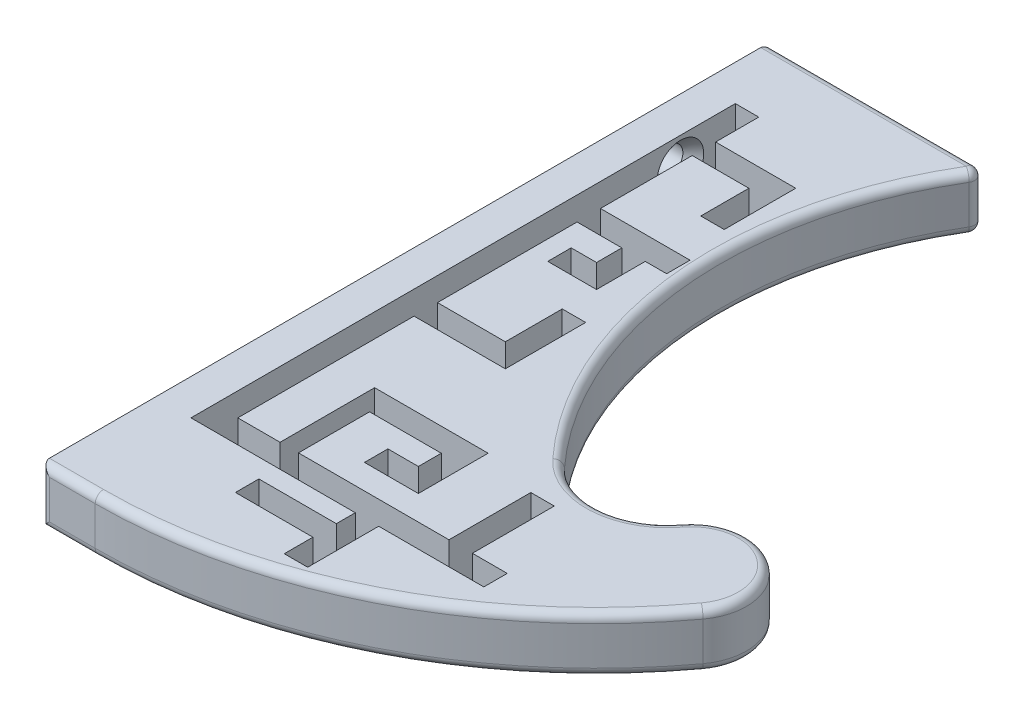
from build123d import *

# Parameters (mm, degrees)
BOSS_EXTRUDE1_DEPTH = 10
FILLET1_R           = 1.5


with BuildPart() as part:
    # Sketch1 → Boss-Extrude1 (new body)
    with BuildSketch(Plane(origin=(0, 0, 0), x_dir=(1, 0, 0), z_dir=(0, 1, 0))):
        with BuildLine():
            Line((0, 132), (0, 0))
            Line((0, 0), (9.806899205, 0))
            ThreePointArc((9.806899205, 0), (50.833969992, 9.773283566), (83.048530962, 36.993857965))
            ThreePointArc((83.048530962, 36.993857965), (81.000199646, 50.92844911), (67.049362803, 48.993857965))
            ThreePointArc((67.049362803, 48.993857965), (57.146860922, 43.813297067), (46.819761712, 48.085155754))
            ThreePointArc((46.819761712, 48.085155754), (29.029737588, 88.873903236), (40, 132))
            Line((40, 132), (0, 132))
        make_face()
        Polygon((6.5, 20.67103065), (6.5, 119.400046722), (10.75, 119.400046722), (10.75, 111.574341839), (25.276432371, 111.574341839), (25.276432371, 107.324341839), (25.276432371, 98.607245151), (21.026432371, 98.607245151), (21.026432371, 107.324341839), (10.75, 107.324341839), (10.75, 90.692748994), (26.995661983, 90.692748994), (26.995661983, 86.442748994), (23.122830992, 86.442748994), (23.122830992, 77.602272136), (18.872830992, 77.602272136), (14.275783025, 77.602272136), (14.275783025, 81.852272136), (18.872830992, 81.852272136), (18.872830992, 86.442748994), (10.75, 86.442748994), (10.75, 61.130194379), (23.055943787, 61.130194379), (23.055943787, 71.449300242), (27.305943787, 71.449300242), (27.305943787, 61.130194379), (27.305943787, 56.880194379), (10.75, 56.880194379), (10.75, 24.92103065), (18.412851079, 24.92103065), (18.412851079, 42.066790132), (21.749945206, 42.066790132), (39.003105081, 42.066790132), (39.003105081, 37.816790132), (39.003105081, 29.408846891), (34.753105081, 29.408846891), (29.22963894, 29.408846891), (29.22963894, 33.658846891), (34.753105081, 33.658846891), (34.753105081, 37.816790132), (21.749945206, 37.816790132), (21.749945206, 24.92103065), (49.043283634, 24.92103065), (49.043283634, 39.766503131), (53.293283634, 39.766503131), (53.293283634, 24.92103065), (59.608702719, 24.92103065), (59.608702719, 20.67103065), (40.548717705, 20.67103065), (40.548717705, 7.79221883), (36.298717705, 7.79221883), (36.298717705, 12.986428014), (22.249875285, 12.986428014), (22.249875285, 17.236428014), (36.298717705, 17.236428014), (36.298717705, 20.67103065), (10.75, 20.67103065), align=None, mode=Mode.SUBTRACT)
    extrude(amount=BOSS_EXTRUDE1_DEPTH)

    # Fillet1
    fillet1_edges = [part.edges().sort_by_distance(p)[0] for p in [
        (0, 5, 0),
        (0, 5, -132),
        (40, 5, -132),
        (4.903449602, 10, 0),
        (50.833969992, 10, -9.773283566),
        (81.000199646, 10, -50.92844911),
        (57.146860922, 10, -43.813297067),
        (29.029737588, 10, -88.873903236),
        (20, 10, -132),
        (20, 0, -132),
        (29.029737588, 0, -88.873903236),
        (57.146860922, 0, -43.813297067),
        (81.000199646, 0, -50.92844911),
        (50.833969992, 0, -9.773283566),
        (4.903449602, 0, 0),
    ]]
    fillet(fillet1_edges, radius=FILLET1_R)

    # Sketch5 → CSK for #8 Flat Head Machine Screw2 (revolve, cut)
    with BuildSketch(Plane(origin=(6.5, 5, -109.449341839), x_dir=(0, 0, -1), z_dir=(0, 1, 0))):
        Polygon((0, 0), (0, 11.476584928), (2.45745, 10), (2.45745, 2.02344051), (4.2164, 0), align=None)
    revolve(axis=Axis((12.85, 5, -109.449341839), (-1, 0, 0)), mode=Mode.SUBTRACT)


solid = part.part
